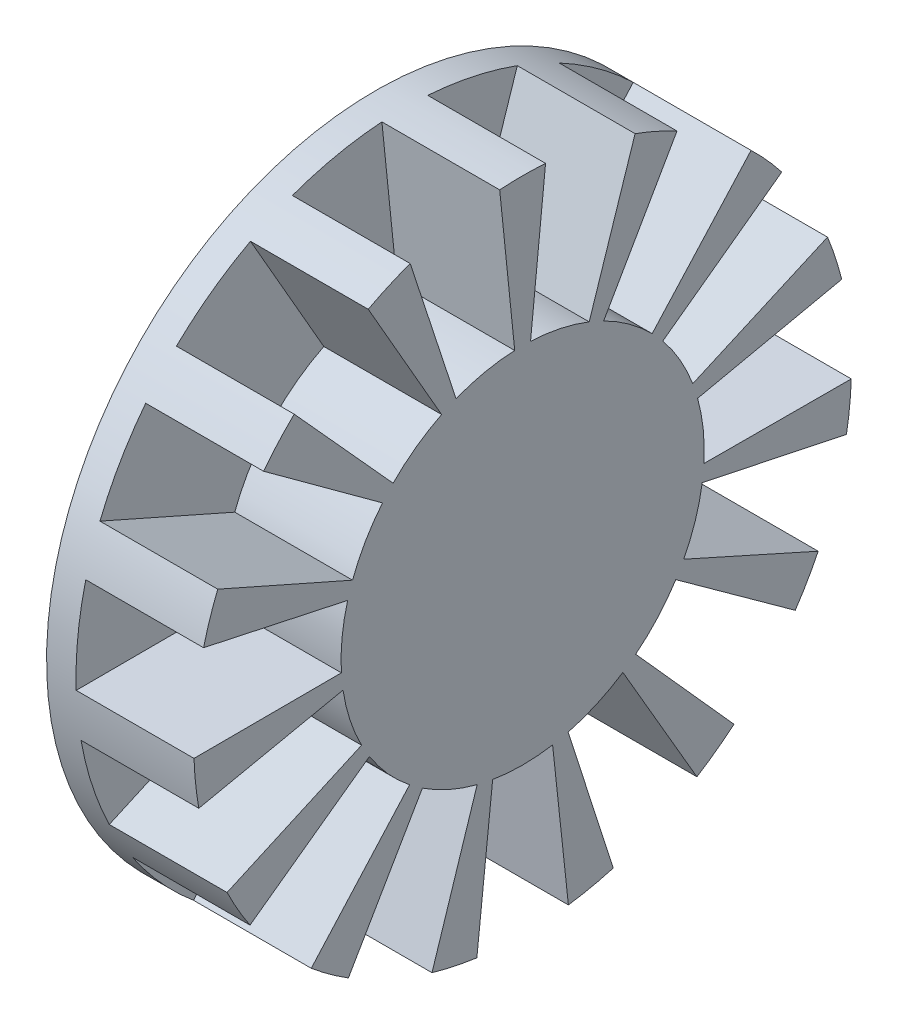
from build123d import *

# Parameters (mm, degrees)
SKETCH1_R           = 33.5
BOSS_EXTRUDE1_DEPTH = 15
CUT_EXTRUDE1_START  = -12
CUT_EXTRUDE1_DEPTH  = 12


with BuildPart() as part:
    # Sketch1 → Boss-Extrude1 (new body)
    with BuildSketch(Plane(origin=(0, 0, 0), x_dir=(0, 0, -1), z_dir=(1, 0, 0))):
        Circle(SKETCH1_R)
    extrude(amount=BOSS_EXTRUDE1_DEPTH)

    # Sketch3 → Cut-Extrude1 (cut)
    with BuildSketch(Plane(origin=(15, 0, 0), x_dir=(0, 0, -1), z_dir=(1, 0, 0)).offset(CUT_EXTRUDE1_START)):
        with BuildLine():
            Line((2.33684187, 33.418395684), (0.806958666, 18.482392099))
            ThreePointArc((0.806958666, 18.482392099), (3.84636628, 18.095730614), (6.780272694, 17.212725008))
            Line((6.780272694, 17.212725008), (11.457674801, 31.479702796))
            ThreePointArc((11.457674801, 31.479702796), (6.965041642, 32.767944625), (2.33684187, 33.418395684))
        make_face()
        with BuildLine():
            Line((15.727297353, 29.578744361), (8.254659543, 16.55628569))
            ThreePointArc((8.254659543, 16.55628569), (10.874027167, 14.966814396), (13.195133309, 12.96682139))
            Line((13.195133309, 12.96682139), (23.27105541, 24.097883311))
            ThreePointArc((23.27105541, 24.097883311), (19.690805952, 27.102069312), (15.727297353, 29.578744361))
        make_face()
        with BuildLine():
            Line((26.398360246, 20.624659423), (14.275054793, 11.767447075))
            ThreePointArc((14.275054793, 11.767447075), (16.02146997, 9.25), (17.328435501, 6.478836553))
            Line((17.328435501, 6.478836553), (31.060659128, 12.549320879))
            ThreePointArc((31.060659128, 12.549320879), (29.011851027, 16.75), (26.398360246, 20.624659423))
        make_face()
        with BuildLine():
            Line((32.50490683, 8.104383503), (17.827163384, 4.943909957))
            ThreePointArc((17.827163384, 4.943909957), (18.398655064, 1.93377657), (18.465493771, -1.129397981))
            Line((18.465493771, -1.129397981), (33.479592705, -1.16913314))
            ThreePointArc((33.479592705, -1.16913314), (33.316483495, 3.501703519), (32.50490683, 8.104383503))
        make_face()
        with BuildLine():
            Line((32.991059726, -5.817213952), (18.296793472, -2.734474106))
            ThreePointArc((18.296793472, -2.734474106), (17.594545551, -5.716814396), (16.409700414, -8.542349345))
            Line((16.409700414, -8.542349345), (30.109600551, -14.685433417))
            ThreePointArc((30.109600551, -14.685433417), (31.860393296, -10.352069312), (32.991059726, -5.817213952))
        make_face()
        with BuildLine():
            Line((27.772758681, -18.732962266), (15.602741748, -9.940042754))
            ThreePointArc((15.602741748, -9.940042754), (13.748179271, -12.378916218), (11.516520778, -14.478250902))
            Line((11.516520778, -14.478250902), (21.533384924, -25.662488844))
            ThreePointArc((21.533384924, -25.662488844), (24.895351653, -22.415875313), (27.772758681, -18.732962266))
        make_face()
        with BuildLine():
            Line((17.752295352, -28.409611221), (10.210834228, -15.426887708))
            ThreePointArc((10.210834228, -15.426887708), (7.524627897, -16.900590966), (4.632030075, -17.910731347))
            Line((4.632030075, -17.910731347), (9.23385142, -32.202266814))
            ThreePointArc((9.23385142, -32.202266814), (13.625677543, -30.603772831), (17.752295352, -28.409611221))
        make_face()
        with BuildLine():
            Line((4.662298882, -33.173980303), (3.053380708, -18.246283628))
            ThreePointArc((3.053380708, -18.246283628), (0, -18.5), (-3.053380708, -18.246283628))
            Line((-3.053380708, -18.246283628), (-4.662298882, -33.173980303))
            ThreePointArc((-4.662298882, -33.173980303), (0, -33.5), (4.662298882, -33.173980303))
        make_face()
        with BuildLine():
            Line((-9.23385142, -32.202266814), (-4.632030075, -17.910731347))
            ThreePointArc((-4.632030075, -17.910731347), (-7.524627897, -16.900590966), (-10.210834228, -15.426887708))
            Line((-10.210834228, -15.426887708), (-17.752295352, -28.409611221))
            ThreePointArc((-17.752295352, -28.409611221), (-13.625677543, -30.603772831), (-9.23385142, -32.202266814))
        make_face()
        with BuildLine():
            Line((-21.533384924, -25.662488844), (-11.516520778, -14.478250902))
            ThreePointArc((-11.516520778, -14.478250902), (-13.748179271, -12.378916218), (-15.602741748, -9.940042754))
            Line((-15.602741748, -9.940042754), (-27.772758681, -18.732962266))
            ThreePointArc((-27.772758681, -18.732962266), (-24.895351653, -22.415875313), (-21.533384924, -25.662488844))
        make_face()
        with BuildLine():
            Line((-30.109600551, -14.685433417), (-16.409700414, -8.542349345))
            ThreePointArc((-16.409700414, -8.542349345), (-17.594545551, -5.716814396), (-18.296793472, -2.734474106))
            Line((-18.296793472, -2.734474106), (-32.991059726, -5.817213952))
            ThreePointArc((-32.991059726, -5.817213952), (-31.860393296, -10.352069312), (-30.109600551, -14.685433417))
        make_face()
        with BuildLine():
            Line((-33.479592705, -1.16913314), (-18.465493771, -1.129397981))
            ThreePointArc((-18.465493771, -1.129397981), (-18.398655064, 1.93377657), (-17.827163384, 4.943909957))
            Line((-17.827163384, 4.943909957), (-32.50490683, 8.104383503))
            ThreePointArc((-32.50490683, 8.104383503), (-33.316483495, 3.501703519), (-33.479592705, -1.16913314))
        make_face()
        with BuildLine():
            Line((-31.060659128, 12.549320879), (-17.328435501, 6.478836553))
            ThreePointArc((-17.328435501, 6.478836553), (-16.02146997, 9.25), (-14.275054793, 11.767447075))
            Line((-14.275054793, 11.767447075), (-26.398360246, 20.624659423))
            ThreePointArc((-26.398360246, 20.624659423), (-29.011851027, 16.75), (-31.060659128, 12.549320879))
        make_face()
        with BuildLine():
            Line((-23.27105541, 24.097883311), (-13.195133309, 12.96682139))
            ThreePointArc((-13.195133309, 12.96682139), (-10.874027167, 14.966814396), (-8.254659543, 16.55628569))
            Line((-8.254659543, 16.55628569), (-15.727297353, 29.578744361))
            ThreePointArc((-15.727297353, 29.578744361), (-19.690805952, 27.102069312), (-23.27105541, 24.097883311))
        make_face()
        with BuildLine():
            Line((-11.457674801, 31.479702796), (-6.780272694, 17.212725008))
            ThreePointArc((-6.780272694, 17.212725008), (-3.84636628, 18.095730614), (-0.806958666, 18.482392099))
            Line((-0.806958666, 18.482392099), (-2.33684187, 33.418395684))
            ThreePointArc((-2.33684187, 33.418395684), (-6.965041642, 32.767944625), (-11.457674801, 31.479702796))
        make_face()
    extrude(amount=CUT_EXTRUDE1_DEPTH, mode=Mode.SUBTRACT)


solid = part.part
